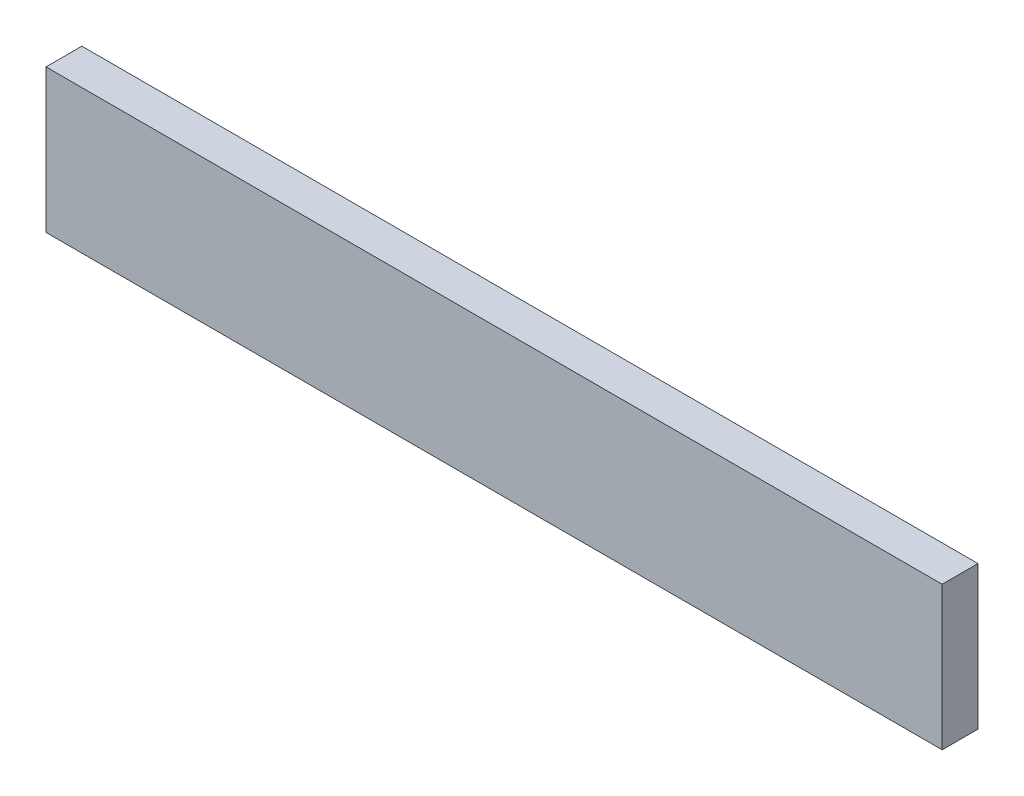
from build123d import *

# Parameters (mm, degrees)
SKETCH1_W           = 50
SKETCH1_H           = 8
BOSS_EXTRUDE1_DEPTH = 2


with BuildPart() as part:
    # Sketch1 → Boss-Extrude1 (new body)
    with BuildSketch(Plane.XY):
        with Locations((25, -4)):
            Rectangle(SKETCH1_W, SKETCH1_H)
    extrude(amount=BOSS_EXTRUDE1_DEPTH)


solid = part.part
